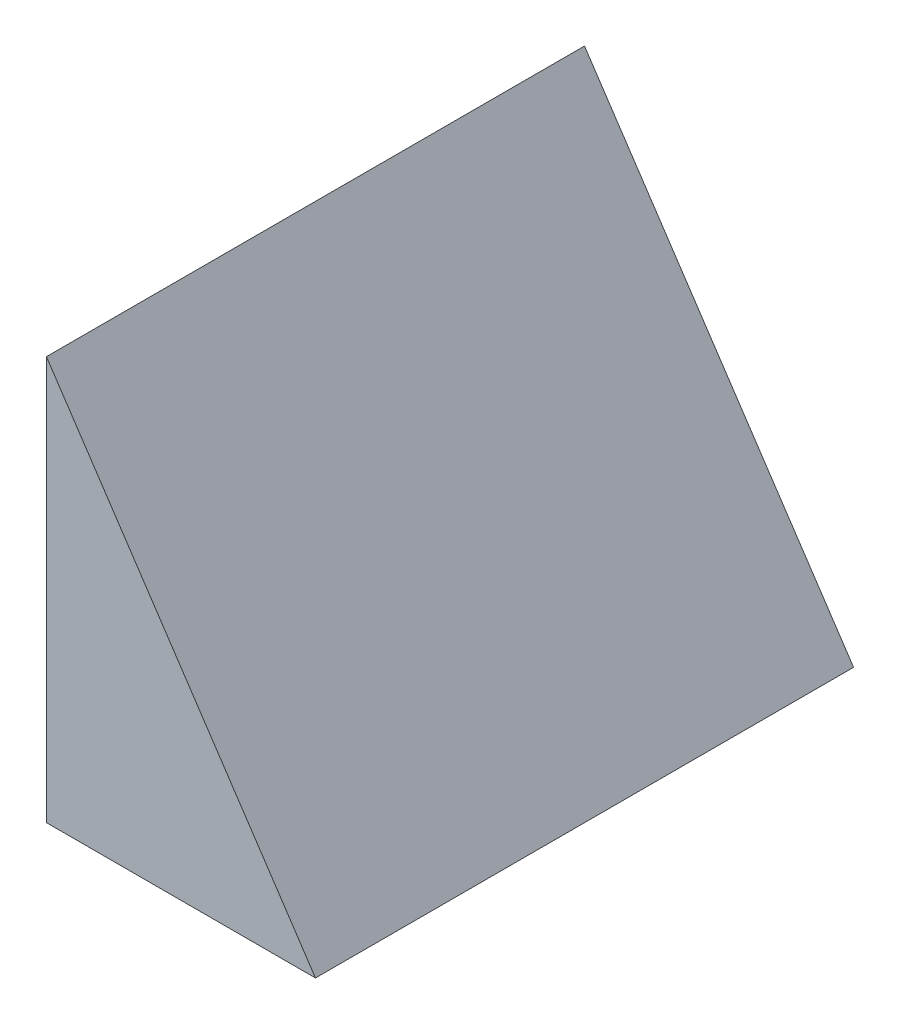
from build123d import *

# Parameters (mm, degrees)
WEDGE_10_15_20_DEPTH = 20


with BuildPart() as part:
    # Croquis1 → Wedge 10 15 20 (new body)
    with BuildSketch(Plane.XY):
        Polygon((0, 0), (10, 0), (0, 15), align=None)
    extrude(amount=WEDGE_10_15_20_DEPTH)


solid = part.part
